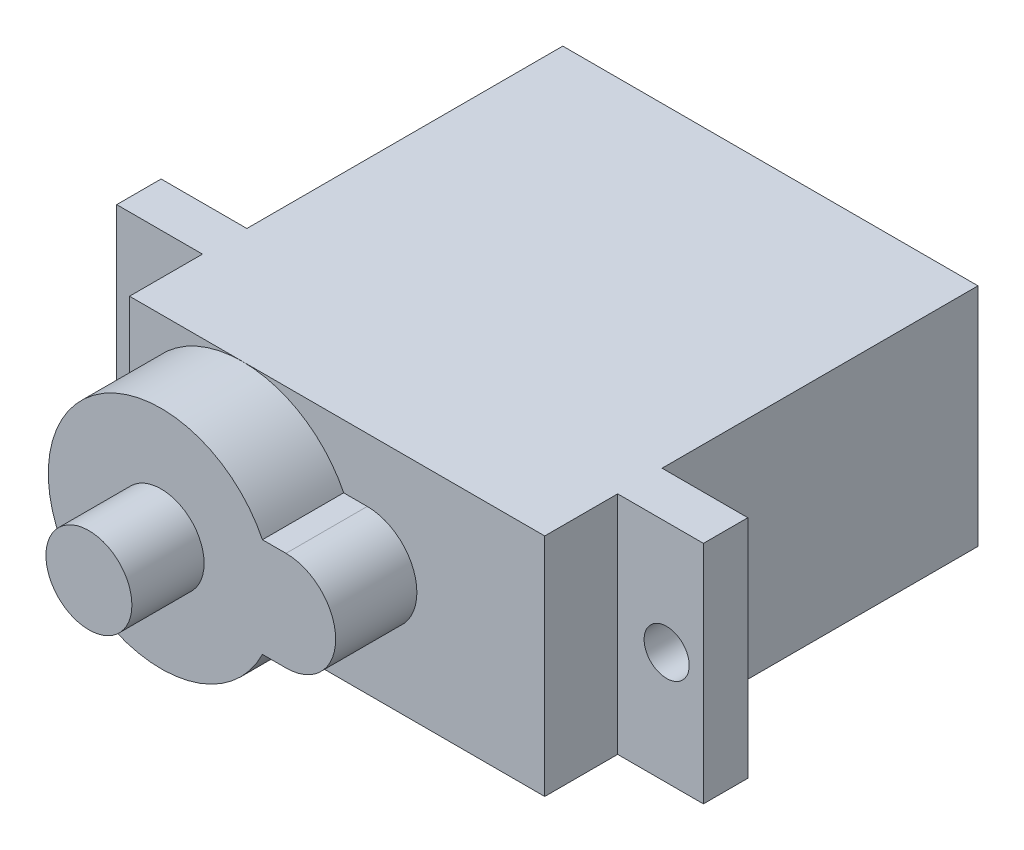
from build123d import *

# Parameters (mm, degrees)
SKETCH_1_W          = 23
SKETCH_1_H          = 12.5
EXTRUDE_1_DEPTH     = 24
SKETCH_2_W          = 32.5
SKETCH_2_H          = 12.5
EXTRUDE_2_DEPTH     = 2.46
EXTRUDE_3_DEPTH     = 4.5
SKETCH_4_R          = 2.381232182
EXTRUDE_4_DEPTH     = 4
SKETCH_6_R          = 1.25
CUT_EXTRUDE_1_DEPTH = 37.396622096


with BuildPart() as part:
    # 草图1 → 凸台-拉伸1 (new body)
    with BuildSketch(Plane.XY):
        with Locations((11.5, -6.25)):
            Rectangle(SKETCH_1_W, SKETCH_1_H)
    extrude(amount=EXTRUDE_1_DEPTH)

    # 草图2 → 凸台-拉伸2 (add)
    with BuildSketch(Plane.XY.offset(17.5)):
        with Locations((11.5, -6.25)):
            Rectangle(SKETCH_2_W, SKETCH_2_H)
    extrude(amount=EXTRUDE_2_DEPTH)

    # 草图3 → 凸台-拉伸3 (add)
    with BuildSketch(Plane.XY.offset(24)):
        with BuildLine():
            Line((13.167793033, -3.5), (11.86248608, -3.5))
            ThreePointArc((11.86248608, -3.5), (0, -6.25), (11.86248608, -9))
            Line((11.86248608, -9), (13.167793033, -9))
            ThreePointArc((13.167793033, -9), (15.917793033, -6.25), (13.167793033, -3.5))
        make_face()
    extrude(amount=EXTRUDE_3_DEPTH)

    # 草图4 → 凸台-拉伸4 (add)
    with BuildSketch(Plane.XY.offset(28.5)):
        with Locations((6.25, -6.25)):
            Circle(SKETCH_4_R)
    extrude(amount=EXTRUDE_4_DEPTH)

    # 草图6 → 切除-拉伸1 (cut, through all)
    with BuildSketch(Plane.XY.offset(19.96)):
        with Locations((-2.286532447, -6.25)):
            Circle(SKETCH_6_R)
        with Locations((25.713467553, -6.25)):
            Circle(SKETCH_6_R)
    extrude(amount=-CUT_EXTRUDE_1_DEPTH, mode=Mode.SUBTRACT)


solid = part.part
